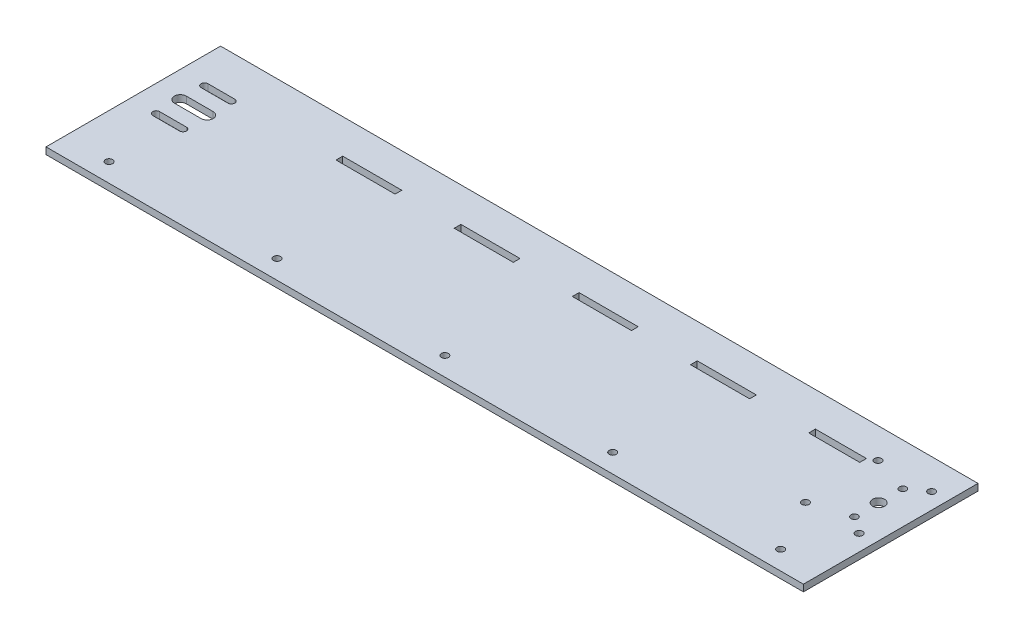
from build123d import *

# Parameters (mm, degrees)
SKETCH1_R           = 2.65
SKETCH1_R_2         = 2.55
SKETCH1_R_3         = 4.5
SKETCH1_W           = 38
SKETCH1_H           = 5
SKETCH1_W_2         = 44
BOSS_EXTRUDE1_DEPTH = 5


with BuildPart() as part:
    # Sketch1 → Boss-Extrude1 (new body)
    with BuildSketch(Plane(origin=(0, 0, 0), x_dir=(1, 0, 0), z_dir=(0, 1, 0))):
        Polygon((0, 0), (0, 40), (0, 65), (-564, 65), (-564, -65), (-524.5, -65), (0, -65), align=None)
        with Locations(Location((-12, 42.5, 0), (0, 0, 270))):
            Circle(SKETCH1_R, mode=Mode.SUBTRACT)
        with Locations(Location((-24.5, 33.5, 0), (0, 0, 270))):
            Circle(SKETCH1_R_2, mode=Mode.SUBTRACT)
        with Locations(Location((-24.5, -2.5, 0), (0, 0, 270))):
            Circle(SKETCH1_R_2, mode=Mode.SUBTRACT)
        with Locations(Location((-24.5, 15.5, 0), (0, 0, 270))):
            Circle(SKETCH1_R_3, mode=Mode.SUBTRACT)
        with Locations(Location((-12, -11.5, 0), (0, 0, 270))):
            Circle(SKETCH1_R, mode=Mode.SUBTRACT)
        with Locations(Location((-531, -51, 0), (0, 0, 270))):
            Circle(SKETCH1_R, mode=Mode.SUBTRACT)
        with Locations(Location((-406, -51, 0), (0, 0, 270))):
            Circle(SKETCH1_R, mode=Mode.SUBTRACT)
        with Locations(Location((-281, -51, 0), (0, 0, 270))):
            Circle(SKETCH1_R, mode=Mode.SUBTRACT)
        with Locations(Location((-156, -51, 0), (0, 0, 270))):
            Circle(SKETCH1_R, mode=Mode.SUBTRACT)
        with Locations(Location((-52, -11.5, 0), (0, 0, 270))):
            Circle(SKETCH1_R, mode=Mode.SUBTRACT)
        with Locations(Location((-52, 42.5, 0), (0, 0, 270))):
            Circle(SKETCH1_R, mode=Mode.SUBTRACT)
        with Locations(Location((-31, -51, 0), (0, 0, 270))):
            Circle(SKETCH1_R, mode=Mode.SUBTRACT)
        with Locations((-76.559496053, 37)):
            Rectangle(SKETCH1_W, SKETCH1_H, mode=Mode.SUBTRACT)
        with BuildLine():
            Line((-544.5, 36.05), (-524.5, 36.05))
            ThreePointArc((-524.5, 36.05), (-521.95, 33.5), (-524.5, 30.95))
            Line((-524.5, 30.95), (-544.5, 30.95))
            ThreePointArc((-544.5, 30.95), (-547.05, 33.5), (-544.5, 36.05))
        make_face(mode=Mode.SUBTRACT)
        with BuildLine():
            Line((-524.5, 0.05), (-544.5, 0.05))
            ThreePointArc((-544.5, 0.05), (-547.05, -2.5), (-544.5, -5.05))
            Line((-544.5, -5.05), (-524.5, -5.05))
            ThreePointArc((-524.5, -5.05), (-521.95, -2.5), (-524.5, 0.05))
        make_face(mode=Mode.SUBTRACT)
        with BuildLine():
            Line((-544.5, 20), (-524.5, 20))
            ThreePointArc((-524.5, 20), (-520, 15.5), (-524.5, 11))
            Line((-524.5, 11), (-544.5, 11))
            ThreePointArc((-544.5, 11), (-549, 15.5), (-544.5, 20))
        make_face(mode=Mode.SUBTRACT)
        with Locations((-161.559496053, 37)):
            Rectangle(SKETCH1_W_2, SKETCH1_H, mode=Mode.SUBTRACT)
        with Locations((-249.559496053, 37)):
            Rectangle(SKETCH1_W_2, SKETCH1_H, mode=Mode.SUBTRACT)
        with Locations((-337.559496053, 37)):
            Rectangle(SKETCH1_W_2, SKETCH1_H, mode=Mode.SUBTRACT)
        with Locations((-425.559496053, 37)):
            Rectangle(SKETCH1_W_2, SKETCH1_H, mode=Mode.SUBTRACT)
    extrude(amount=BOSS_EXTRUDE1_DEPTH)


solid = part.part
